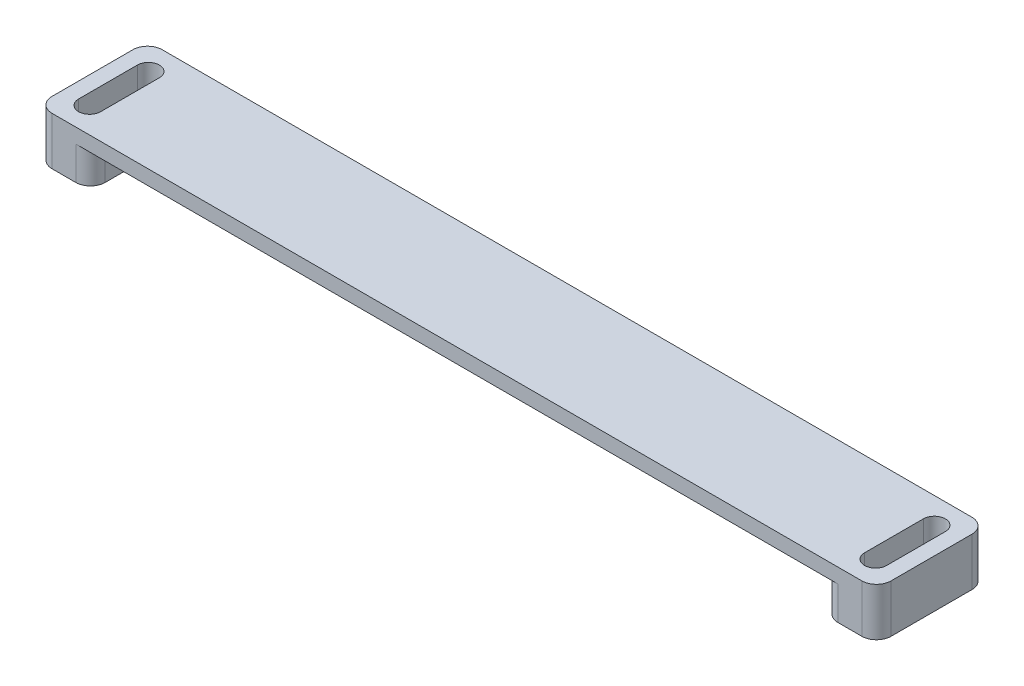
from build123d import *

# Parameters (mm, degrees)
SKETCH_1_W          = 97
SKETCH_1_H          = 1.5
EXTRUDE_1_DEPTH     = 2
EXTRUDE_1_2_DEPTH   = 2
EXTRUDE_1_3_DEPTH   = 2
SKETCH_2_W          = 114.23
SKETCH_2_H          = 15
EXTRUDE_2_DEPTH     = 2
CUT_EXTRUDE_1_DEPTH = 10
FILLET_1_R          = 2
EXTRUDE_3_DEPTH     = 4.54


with BuildPart() as part:
    # 草图1 → 凸台-拉伸1 (new body)
    with BuildSketch(Plane(origin=(0, 0, 0), x_dir=(1, 0, 0), z_dir=(0, 1, 0))):
        Rectangle(SKETCH_1_W, SKETCH_1_H)
    extrude(amount=EXTRUDE_1_DEPTH)



with BuildPart() as body_2:
    # 草图1 → Extrude 1 2 (new body)
    with BuildSketch(Plane(origin=(0, 0, 0), x_dir=(1, 0, 0), z_dir=(0, 1, 0))):
        with Locations((0, -3.4)):
            Rectangle(SKETCH_1_W, SKETCH_1_H)
    extrude(amount=EXTRUDE_1_2_DEPTH)


with BuildPart() as body_3:
    # 草图1 → Extrude 1 3 (new body)
    with BuildSketch(Plane(origin=(0, 0, 0), x_dir=(1, 0, 0), z_dir=(0, 1, 0))):
        with Locations((0, -6.8)):
            Rectangle(SKETCH_1_W, SKETCH_1_H)
    extrude(amount=EXTRUDE_1_3_DEPTH)


with BuildPart() as part_1:
    add(part.part)

    add(body_2.part)  # 凸台-拉伸2 merges body 2

    add(body_3.part)  # 凸台-拉伸2 merges body 3
    # 草图2 → 凸台-拉伸2 (add)
    with BuildSketch(Plane(origin=(0, 2, 0), x_dir=(1, 0, 0), z_dir=(0, 1, 0))):
        with Locations((0, -3.4)):
            Rectangle(SKETCH_2_W, SKETCH_2_H)
    extrude(amount=EXTRUDE_2_DEPTH)

    # 草图3 → 切除-拉伸1 (cut)
    with BuildSketch(Plane(origin=(0, 4, 0), x_dir=(1, 0, 0), z_dir=(0, 1, 0))):
        with BuildLine():
            Line((-53.5, 2.1), (-53.5, -3.4))
            Line((-53.5, -3.4), (-52, -3.4))
            Line((-52, -3.4), (-52, 0.6))
            ThreePointArc((-52, 0.6), (-52.439339828, 1.660660172), (-53.5, 2.1))
        make_face()
        with BuildLine():
            Line((-55, 0.6), (-55, -3.4))
            Line((-55, -3.4), (-53.5, -3.4))
            Line((-53.5, -3.4), (-53.5, 2.1))
            ThreePointArc((-53.5, 2.1), (-54.560660172, 1.660660172), (-55, 0.6))
        make_face()
        with BuildLine():
            Line((-53.5, -3.4), (-55, -3.4))
            Line((-55, -3.4), (-55, -7.4))
            ThreePointArc((-55, -7.4), (-53.5, -8.9), (-52, -7.4))
            Line((-52, -7.4), (-52, -3.4))
            Line((-52, -3.4), (-53.5, -3.4))
        make_face()
        with BuildLine():
            Line((53.5, -3.4), (52, -3.4))
            Line((52, -3.4), (52, -7.4))
            ThreePointArc((52, -7.4), (53.5, -8.9), (55, -7.4))
            Line((55, -7.4), (55, -3.4))
            Line((55, -3.4), (53.5, -3.4))
        make_face()
        with BuildLine():
            Line((53.5, 2.1), (53.5, -3.4))
            Line((53.5, -3.4), (55, -3.4))
            Line((55, -3.4), (55, 0.6))
            ThreePointArc((55, 0.6), (54.560660172, 1.660660172), (53.5, 2.1))
        make_face()
        with BuildLine():
            Line((52, 0.6), (52, -3.4))
            Line((52, -3.4), (53.5, -3.4))
            Line((53.5, -3.4), (53.5, 2.1))
            ThreePointArc((53.5, 2.1), (52.439339828, 1.660660172), (52, 0.6))
        make_face()
    extrude(amount=-CUT_EXTRUDE_1_DEPTH, mode=Mode.SUBTRACT)

    # 圆角1
    fillet_1_edges = [part_1.edges().sort_by_distance(p)[0] for p in [
        (57.115, 3, 10.9),
        (57.115, 3, -4.1),
        (-57.115, 3, -4.1),
        (-57.115, 3, 10.9),
    ]]
    fillet(fillet_1_edges, radius=FILLET_1_R)

    # 草图4 → 凸台-拉伸3 (add)
    # profile 1 of 2: a face of its own
    with BuildSketch(Plane.XZ.offset(-2)):
        with BuildLine():
            Line((55.115, 10.9), (51.885, 10.9))
            ThreePointArc((51.885, 10.9), (50.470786438, 10.314213562), (49.885, 8.9))
            Line((49.885, 8.9), (49.885, -2.1))
            ThreePointArc((49.885, -2.1), (50.470786438, -3.514213562), (51.885, -4.1))
            Line((51.885, -4.1), (55.115, -4.1))
            ThreePointArc((55.115, -4.1), (56.529213562, -3.514213562), (57.115, -2.1))
            Line((57.115, -2.1), (57.115, 8.9))
            ThreePointArc((57.115, 8.9), (56.529213562, 10.314213562), (55.115, 10.9))
        make_face()
        with BuildLine():
            Line((55, 7.4), (55, -0.6))
            ThreePointArc((55, -0.6), (53.5, -2.1), (52, -0.6))
            Line((52, -0.6), (52, 7.4))
            ThreePointArc((52, 7.4), (53.5, 8.9), (55, 7.4))
        make_face(mode=Mode.SUBTRACT)
    # profile 2 of 2: a face of its own
    with BuildSketch(Plane.XZ.offset(-2)):
        with BuildLine():
            Line((-49.885, -2.1), (-49.885, 8.9))
            ThreePointArc((-49.885, 8.9), (-50.470786438, 10.314213562), (-51.885, 10.9))
            Line((-51.885, 10.9), (-55.115, 10.9))
            ThreePointArc((-55.115, 10.9), (-56.529213562, 10.314213562), (-57.115, 8.9))
            Line((-57.115, 8.9), (-57.115, -2.1))
            ThreePointArc((-57.115, -2.1), (-56.529213562, -3.514213562), (-55.115, -4.1))
            Line((-55.115, -4.1), (-51.885, -4.1))
            ThreePointArc((-51.885, -4.1), (-50.470786438, -3.514213562), (-49.885, -2.1))
        make_face()
        with BuildLine():
            ThreePointArc((-55, 7.4), (-53.5, 8.9), (-52, 7.4))
            Line((-52, 7.4), (-52, -0.6))
            ThreePointArc((-52, -0.6), (-53.5, -2.1), (-55, -0.6))
            Line((-55, -0.6), (-55, 7.4))
        make_face(mode=Mode.SUBTRACT)
    extrude(amount=EXTRUDE_3_DEPTH)


solid = part_1.part
